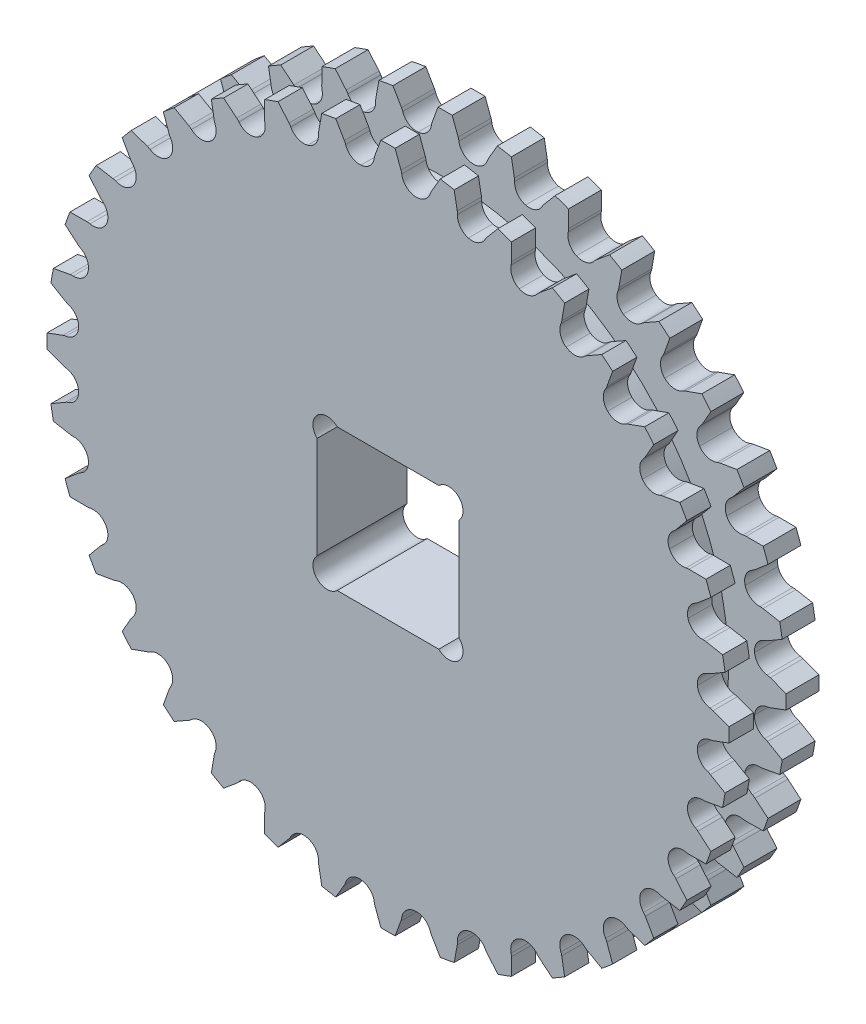
from build123d import *

# Parameters (mm, degrees)
BOSS_EXTRUDE1_DEPTH = 2.7178
SKETCH3_R           = 31.75
BOSS_EXTRUDE2_DEPTH = 3.683
BOSS_EXTRUDE3_START = -7.366
BOSS_EXTRUDE3_DEPTH = 3.683
CUT_EXTRUDE1_DEPTH  = 55.958234211


with BuildPart() as part:
    # Sketch1 → Boss-Extrude1 (new body)
    with BuildSketch(Plane.XY):
        with BuildLine():
            Line((-0.79375, 38.193352871), (-1.455433385, 36.407220044))
            ThreePointArc((-1.455433385, 36.407220044), (-1.506568103, 36.242096667), (-1.539446388, 36.072392492))
            ThreePointArc((-1.539446388, 36.072392492), (-2.036903793, 35.101653222), (-3.031134542, 34.65298428))
            ThreePointArc((-3.031134542, 34.65298428), (-4.088628405, 34.922119937), (-4.747846482, 35.791693855))
            ThreePointArc((-4.747846482, 35.791693855), (-4.809694093, 35.953110589), (-4.888725333, 36.10684592))
            Line((-4.888725333, 36.10684592), (-5.850514971, 37.750943262))
            ThreePointArc((-5.850514971, 37.750943262), (-6.633638224, 37.621231857), (-7.413897279, 37.475276779))
            Line((-7.413897279, 37.475276779), (-7.755369496, 35.60137921))
            ThreePointArc((-7.755369496, 35.60137921), (-7.777053989, 35.429884978), (-7.779963958, 35.257049736))
            ThreePointArc((-7.779963958, 35.257049736), (-8.101296763, 34.214675605), (-9.002512368, 33.600176594))
            ThreePointArc((-9.002512368, 33.600176594), (-10.090853136, 33.681184022), (-10.890878439, 34.423482713))
            ThreePointArc((-10.890878439, 34.423482713), (-10.979816168, 34.571707439), (-11.084342606, 34.709383554))
            Line((-11.084342606, 34.709383554), (-12.317015005, 36.161490344))
            ThreePointArc((-12.317015005, 36.161490344), (-13.065716707, 35.897761622), (-13.808777041, 35.618533367))
            Line((-13.808777041, 35.618533367), (-13.81966263, 33.713808484))
            ThreePointArc((-13.81966263, 33.713808484), (-13.811238025, 33.541154162), (-13.784091261, 33.370439364))
            ThreePointArc((-13.784091261, 33.370439364), (-13.91953593, 32.288102383), (-14.700353411, 31.526444545))
            ThreePointArc((-14.700353411, 31.526444545), (-15.78622663, 31.417232897), (-16.702996566, 32.009331467))
            ThreePointArc((-16.702996566, 32.009331467), (-16.816322084, 32.139860452), (-16.943167737, 32.257294132))
            Line((-16.943167737, 32.257294132), (-18.409268771, 33.473288842))
            ThreePointArc((-18.409268771, 33.473288842), (-19.1008, 33.083556065), (-19.7840841, 32.679538842))
            Line((-19.7840841, 32.679538842), (-19.464052307, 30.801860747))
            ThreePointArc((-19.464052307, 30.801860747), (-19.425774583, 30.633292349), (-19.369395925, 30.469885079))
            ThreePointArc((-19.369395925, 30.469885079), (-19.314837041, 29.380471508), (-19.951531655, 28.494797432))
            ThreePointArc((-19.951531655, 28.494797432), (-21.001943616, 28.198685049), (-22.007602595, 28.622592882))
            ThreePointArc((-22.007602595, 28.622592882), (-22.141872564, 28.731460069), (-22.287183291, 28.825083151))
            Line((-22.287183291, 28.825083151), (-23.942166221, 29.768018396))
            ThreePointArc((-23.942166221, 29.768018396), (-24.55551515, 29.264123398), (-25.158261774, 28.747593065))
            Line((-25.158261774, 28.747593065), (-24.517036604, 26.954014058))
            ThreePointArc((-24.517036604, 26.954014058), (-24.45006881, 26.79465345), (-24.366171296, 26.643518754))
            ThreePointArc((-24.366171296, 26.643518754), (-24.123266603, 25.580129874), (-24.596492706, 24.597350318))
            ThreePointArc((-24.596492706, 24.597350318), (-25.579527173, 24.123334424), (-26.643518754, 24.366171296))
            ThreePointArc((-26.643518754, 24.366171296), (-26.79465345, 24.45006881), (-26.954014058, 24.517036604))
            Line((-26.954014058, 24.517036604), (-28.747593065, 25.158261774))
            ThreePointArc((-28.747593065, 25.158261774), (-29.264123398, 24.55551515), (-29.768018396, 23.942166221))
            Line((-29.768018396, 23.942166221), (-28.825083151, 22.287183291))
            ThreePointArc((-28.825083151, 22.287183291), (-28.731460069, 22.141872564), (-28.622592882, 22.007602595))
            ThreePointArc((-28.622592882, 22.007602595), (-28.198722915, 21.002548938), (-28.494101772, 19.952525162))
            ThreePointArc((-28.494101772, 19.952525162), (-29.37988974, 19.315008491), (-30.469885079, 19.369395925))
            ThreePointArc((-30.469885079, 19.369395925), (-30.633292349, 19.425774583), (-30.801860747, 19.464052307))
            Line((-30.801860747, 19.464052307), (-32.679538842, 19.7840841))
            ThreePointArc((-32.679538842, 19.7840841), (-33.083556065, 19.1008), (-33.473288842, 18.409268771))
            Line((-33.473288842, 18.409268771), (-32.257294132, 16.943167737))
            ThreePointArc((-32.257294132, 16.943167737), (-32.139860452, 16.816322084), (-32.009331467, 16.702996566))
            ThreePointArc((-32.009331467, 16.702996566), (-31.417375302, 15.786816181), (-31.525931974, 14.701452624))
            ThreePointArc((-31.525931974, 14.701452624), (-32.287559225, 13.919805797), (-33.370439364, 13.784091261))
            ThreePointArc((-33.370439364, 13.784091261), (-33.541154162, 13.811238025), (-33.713808484, 13.81966263))
            Line((-33.713808484, 13.81966263), (-35.618533367, 13.808777041))
            ThreePointArc((-35.618533367, 13.808777041), (-35.897761622, 13.065716707), (-36.161490344, 12.317015005))
            Line((-36.161490344, 12.317015005), (-34.709383554, 11.084342606))
            ThreePointArc((-34.709383554, 11.084342606), (-34.571707439, 10.979816168), (-34.423482713, 10.890878439))
            ThreePointArc((-34.423482713, 10.890878439), (-33.681426637, 10.091409002), (-33.599862686, 9.003683889))
            ThreePointArc((-33.599862686, 9.003683889), (-34.21445168, 8.102014525), (-35.257049736, 7.779963958))
            ThreePointArc((-35.257049736, 7.779963958), (-35.429884978, 7.777053989), (-35.60137921, 7.755369496))
            Line((-35.60137921, 7.755369496), (-37.475276779, 7.413897279))
            ThreePointArc((-37.475276779, 7.413897279), (-37.621231857, 6.633638224), (-37.750943262, 5.850514971))
            Line((-37.750943262, 5.850514971), (-36.10684592, 4.888725333))
            ThreePointArc((-36.10684592, 4.888725333), (-35.953110589, 4.809694093), (-35.791693855, 4.747846482))
            ThreePointArc((-35.791693855, 4.747846482), (-34.922084868, 4.089379467), (-34.652878573, 3.032342774))
            ThreePointArc((-34.652878573, 3.032342774), (-35.101557337, 2.037649535), (-36.072392492, 1.539446388))
            ThreePointArc((-36.072392492, 1.539446388), (-36.242096667, 1.506568103), (-36.407220044, 1.455433385))
            Line((-36.407220044, 1.455433385), (-38.193352871, 0.79375))
            ThreePointArc((-38.193352871, 0.79375), (-38.2016, 0), (-38.193352871, -0.79375))
            Line((-38.193352871, -0.79375), (-36.407220044, -1.455433385))
            ThreePointArc((-36.407220044, -1.455433385), (-36.242096667, -1.506568103), (-36.072392492, -1.539446388))
            ThreePointArc((-36.072392492, -1.539446388), (-35.101653222, -2.036903793), (-34.65298428, -3.031134542))
            ThreePointArc((-34.65298428, -3.031134542), (-34.922119937, -4.088628405), (-35.791693855, -4.747846482))
            ThreePointArc((-35.791693855, -4.747846482), (-35.953110589, -4.809694093), (-36.10684592, -4.888725333))
            Line((-36.10684592, -4.888725333), (-37.750943262, -5.850514971))
            ThreePointArc((-37.750943262, -5.850514971), (-37.621231857, -6.633638224), (-37.475276779, -7.413897279))
            Line((-37.475276779, -7.413897279), (-35.60137921, -7.755369496))
            ThreePointArc((-35.60137921, -7.755369496), (-35.429884978, -7.777053989), (-35.257049736, -7.779963958))
            ThreePointArc((-35.257049736, -7.779963958), (-34.214675605, -8.101296763), (-33.600176594, -9.002512368))
            ThreePointArc((-33.600176594, -9.002512368), (-33.681591594, -10.09067544), (-34.423482713, -10.890878439))
            ThreePointArc((-34.423482713, -10.890878439), (-34.571707439, -10.979816168), (-34.709383554, -11.084342606))
            Line((-34.709383554, -11.084342606), (-36.161490344, -12.317015005))
            ThreePointArc((-36.161490344, -12.317015005), (-35.897761622, -13.065716707), (-35.618533367, -13.808777041))
            Line((-35.618533367, -13.808777041), (-33.713808484, -13.81966263))
            ThreePointArc((-33.713808484, -13.81966263), (-33.541154162, -13.811238025), (-33.370439364, -13.784091261))
            ThreePointArc((-33.370439364, -13.784091261), (-32.288102383, -13.91953593), (-31.526444545, -14.700353411))
            ThreePointArc((-31.526444545, -14.700353411), (-31.417665134, -15.786122407), (-32.009331467, -16.702996566))
            ThreePointArc((-32.009331467, -16.702996566), (-32.139860452, -16.816322084), (-32.257294132, -16.943167737))
            Line((-32.257294132, -16.943167737), (-33.473288842, -18.409268771))
            ThreePointArc((-33.473288842, -18.409268771), (-33.083556065, -19.1008), (-32.679538842, -19.7840841))
            Line((-32.679538842, -19.7840841), (-30.801860747, -19.464052307))
            ThreePointArc((-30.801860747, -19.464052307), (-30.633292349, -19.425774583), (-30.469885079, -19.369395925))
            ThreePointArc((-30.469885079, -19.369395925), (-29.380471508, -19.314837041), (-28.494797432, -19.951531655))
            ThreePointArc((-28.494797432, -19.951531655), (-28.198685049, -21.001943616), (-28.622592882, -22.007602595))
            ThreePointArc((-28.622592882, -22.007602595), (-28.731460069, -22.141872564), (-28.825083151, -22.287183291))
            Line((-28.825083151, -22.287183291), (-29.768018396, -23.942166221))
            ThreePointArc((-29.768018396, -23.942166221), (-29.264123398, -24.55551515), (-28.747593065, -25.158261774))
            Line((-28.747593065, -25.158261774), (-26.954014058, -24.517036604))
            ThreePointArc((-26.954014058, -24.517036604), (-26.79465345, -24.45006881), (-26.643518754, -24.366171296))
            ThreePointArc((-26.643518754, -24.366171296), (-25.580129874, -24.123266603), (-24.597350318, -24.596492706))
            ThreePointArc((-24.597350318, -24.596492706), (-24.12377624, -25.579577069), (-24.366171296, -26.643518754))
            ThreePointArc((-24.366171296, -26.643518754), (-24.45006881, -26.79465345), (-24.517036604, -26.954014058))
            Line((-24.517036604, -26.954014058), (-25.158261774, -28.747593065))
            ThreePointArc((-25.158261774, -28.747593065), (-24.55551515, -29.264123398), (-23.942166221, -29.768018396))
            Line((-23.942166221, -29.768018396), (-22.287183291, -28.825083151))
            ThreePointArc((-22.287183291, -28.825083151), (-22.141872564, -28.731460069), (-22.007602595, -28.622592882))
            ThreePointArc((-22.007602595, -28.622592882), (-21.002548938, -28.198722915), (-19.952525162, -28.494101772))
            ThreePointArc((-19.952525162, -28.494101772), (-19.31543493, -29.380015599), (-19.369395925, -30.469885079))
            ThreePointArc((-19.369395925, -30.469885079), (-19.425774583, -30.633292349), (-19.464052307, -30.801860747))
            Line((-19.464052307, -30.801860747), (-19.7840841, -32.679538842))
            ThreePointArc((-19.7840841, -32.679538842), (-19.1008, -33.083556065), (-18.409268771, -33.473288842))
            Line((-18.409268771, -33.473288842), (-16.943167737, -32.257294132))
            ThreePointArc((-16.943167737, -32.257294132), (-16.816322084, -32.139860452), (-16.702996566, -32.009331467))
            ThreePointArc((-16.702996566, -32.009331467), (-15.786816181, -31.417375302), (-14.701452624, -31.525931974))
            ThreePointArc((-14.701452624, -31.525931974), (-13.920203903, -32.287757222), (-13.784091261, -33.370439364))
            ThreePointArc((-13.784091261, -33.370439364), (-13.811238025, -33.541154162), (-13.81966263, -33.713808484))
            Line((-13.81966263, -33.713808484), (-13.808777041, -35.618533367))
            ThreePointArc((-13.808777041, -35.618533367), (-13.065716707, -35.897761622), (-12.317015005, -36.161490344))
            Line((-12.317015005, -36.161490344), (-11.084342606, -34.709383554))
            ThreePointArc((-11.084342606, -34.709383554), (-10.979816168, -34.571707439), (-10.890878439, -34.423482713))
            ThreePointArc((-10.890878439, -34.423482713), (-10.091409002, -33.681426637), (-9.003683889, -33.599862686))
            ThreePointArc((-9.003683889, -33.599862686), (-8.102014525, -34.21445168), (-7.779963958, -35.257049736))
            ThreePointArc((-7.779963958, -35.257049736), (-7.777053989, -35.429884978), (-7.755369496, -35.60137921))
            Line((-7.755369496, -35.60137921), (-7.413897279, -37.475276779))
            ThreePointArc((-7.413897279, -37.475276779), (-6.633638224, -37.621231857), (-5.850514971, -37.750943262))
            Line((-5.850514971, -37.750943262), (-4.888725333, -36.10684592))
            ThreePointArc((-4.888725333, -36.10684592), (-4.809694093, -35.953110589), (-4.747846482, -35.791693855))
            ThreePointArc((-4.747846482, -35.791693855), (-4.089379467, -34.922084868), (-3.032342774, -34.652878573))
            ThreePointArc((-3.032342774, -34.652878573), (-2.037649535, -35.101557337), (-1.539446388, -36.072392492))
            ThreePointArc((-1.539446388, -36.072392492), (-1.506568103, -36.242096667), (-1.455433385, -36.407220044))
            Line((-1.455433385, -36.407220044), (-0.79375, -38.193352871))
            ThreePointArc((-0.79375, -38.193352871), (0, -38.2016), (0.79375, -38.193352871))
            Line((0.79375, -38.193352871), (1.455433385, -36.407220044))
            ThreePointArc((1.455433385, -36.407220044), (1.506568103, -36.242096667), (1.539446388, -36.072392492))
            ThreePointArc((1.539446388, -36.072392492), (2.036903793, -35.101653222), (3.031134542, -34.65298428))
            ThreePointArc((3.031134542, -34.65298428), (4.088628405, -34.922119937), (4.747846482, -35.791693855))
            ThreePointArc((4.747846482, -35.791693855), (4.809694093, -35.953110589), (4.888725333, -36.10684592))
            Line((4.888725333, -36.10684592), (5.850514971, -37.750943262))
            ThreePointArc((5.850514971, -37.750943262), (6.633638224, -37.621231857), (7.413897279, -37.475276779))
            Line((7.413897279, -37.475276779), (7.755369496, -35.60137921))
            ThreePointArc((7.755369496, -35.60137921), (7.777053989, -35.429884978), (7.779963958, -35.257049736))
            ThreePointArc((7.779963958, -35.257049736), (8.101296763, -34.214675605), (9.002512368, -33.600176594))
            ThreePointArc((9.002512368, -33.600176594), (10.09067544, -33.681591594), (10.890878439, -34.423482713))
            ThreePointArc((10.890878439, -34.423482713), (10.979816168, -34.571707439), (11.084342606, -34.709383554))
            Line((11.084342606, -34.709383554), (12.317015005, -36.161490344))
            ThreePointArc((12.317015005, -36.161490344), (13.065716707, -35.897761622), (13.808777041, -35.618533367))
            Line((13.808777041, -35.618533367), (13.81966263, -33.713808484))
            ThreePointArc((13.81966263, -33.713808484), (13.811238025, -33.541154162), (13.784091261, -33.370439364))
            ThreePointArc((13.784091261, -33.370439364), (13.91953593, -32.288102383), (14.700353411, -31.526444545))
            ThreePointArc((14.700353411, -31.526444545), (15.78622663, -31.417232897), (16.702996566, -32.009331467))
            ThreePointArc((16.702996566, -32.009331467), (16.816322084, -32.139860452), (16.943167737, -32.257294132))
            Line((16.943167737, -32.257294132), (18.409268771, -33.473288842))
            ThreePointArc((18.409268771, -33.473288842), (19.1008, -33.083556065), (19.7840841, -32.679538842))
            Line((19.7840841, -32.679538842), (19.464052307, -30.801860747))
            ThreePointArc((19.464052307, -30.801860747), (19.425774583, -30.633292349), (19.369395925, -30.469885079))
            ThreePointArc((19.369395925, -30.469885079), (19.314837041, -29.380471508), (19.951531655, -28.494797432))
            ThreePointArc((19.951531655, -28.494797432), (21.001916034, -28.199128817), (22.007602595, -28.622592882))
            ThreePointArc((22.007602595, -28.622592882), (22.141872564, -28.731460069), (22.287183291, -28.825083151))
            Line((22.287183291, -28.825083151), (23.942166221, -29.768018396))
            ThreePointArc((23.942166221, -29.768018396), (24.55551515, -29.264123398), (25.158261774, -28.747593065))
            Line((25.158261774, -28.747593065), (24.517036604, -26.954014058))
            ThreePointArc((24.517036604, -26.954014058), (24.45006881, -26.79465345), (24.366171296, -26.643518754))
            ThreePointArc((24.366171296, -26.643518754), (24.123266603, -25.580129874), (24.596492706, -24.597350318))
            ThreePointArc((24.596492706, -24.597350318), (25.579527173, -24.123334424), (26.643518754, -24.366171296))
            ThreePointArc((26.643518754, -24.366171296), (26.79465345, -24.45006881), (26.954014058, -24.517036604))
            Line((26.954014058, -24.517036604), (28.747593065, -25.158261774))
            ThreePointArc((28.747593065, -25.158261774), (29.264123398, -24.55551515), (29.768018396, -23.942166221))
            Line((29.768018396, -23.942166221), (28.825083151, -22.287183291))
            ThreePointArc((28.825083151, -22.287183291), (28.731460069, -22.141872564), (28.622592882, -22.007602595))
            ThreePointArc((28.622592882, -22.007602595), (28.198722915, -21.002548938), (28.494101772, -19.952525162))
            ThreePointArc((28.494101772, -19.952525162), (29.37988974, -19.315008491), (30.469885079, -19.369395925))
            ThreePointArc((30.469885079, -19.369395925), (30.633292349, -19.425774583), (30.801860747, -19.464052307))
            Line((30.801860747, -19.464052307), (32.679538842, -19.7840841))
            ThreePointArc((32.679538842, -19.7840841), (33.083556065, -19.1008), (33.473288842, -18.409268771))
            Line((33.473288842, -18.409268771), (32.257294132, -16.943167737))
            ThreePointArc((32.257294132, -16.943167737), (32.139860452, -16.816322084), (32.009331467, -16.702996566))
            ThreePointArc((32.009331467, -16.702996566), (31.417375302, -15.786816181), (31.525931974, -14.701452624))
            ThreePointArc((31.525931974, -14.701452624), (32.287559225, -13.919805797), (33.370439364, -13.784091261))
            ThreePointArc((33.370439364, -13.784091261), (33.541154162, -13.811238025), (33.713808484, -13.81966263))
            Line((33.713808484, -13.81966263), (35.618533367, -13.808777041))
            ThreePointArc((35.618533367, -13.808777041), (35.897761622, -13.065716707), (36.161490344, -12.317015005))
            Line((36.161490344, -12.317015005), (34.709383554, -11.084342606))
            ThreePointArc((34.709383554, -11.084342606), (34.571707439, -10.979816168), (34.423482713, -10.890878439))
            ThreePointArc((34.423482713, -10.890878439), (33.681426637, -10.091409002), (33.599862686, -9.003683889))
            ThreePointArc((33.599862686, -9.003683889), (34.214187561, -8.101656849), (35.257049736, -7.779963958))
            ThreePointArc((35.257049736, -7.779963958), (35.429884978, -7.777053989), (35.60137921, -7.755369496))
            Line((35.60137921, -7.755369496), (37.475276779, -7.413897279))
            ThreePointArc((37.475276779, -7.413897279), (37.621231857, -6.633638224), (37.750943262, -5.850514971))
            Line((37.750943262, -5.850514971), (36.10684592, -4.888725333))
            ThreePointArc((36.10684592, -4.888725333), (35.953110589, -4.809694093), (35.791693855, -4.747846482))
            ThreePointArc((35.791693855, -4.747846482), (34.922084868, -4.089379467), (34.652878573, -3.032342774))
            ThreePointArc((34.652878573, -3.032342774), (35.101235121, -2.037343157), (36.072392492, -1.539446388))
            ThreePointArc((36.072392492, -1.539446388), (36.242096667, -1.506568103), (36.407220044, -1.455433385))
            Line((36.407220044, -1.455433385), (38.193352871, -0.79375))
            ThreePointArc((38.193352871, -0.79375), (38.2016, 0), (38.193352871, 0.79375))
            Line((38.193352871, 0.79375), (36.407220044, 1.455433385))
            ThreePointArc((36.407220044, 1.455433385), (36.242096667, 1.506568103), (36.072392492, 1.539446388))
            ThreePointArc((36.072392492, 1.539446388), (35.101653222, 2.036903793), (34.65298428, 3.031134542))
            ThreePointArc((34.65298428, 3.031134542), (34.921749414, 4.088874176), (35.791693855, 4.747846482))
            ThreePointArc((35.791693855, 4.747846482), (35.953110589, 4.809694093), (36.10684592, 4.888725333))
            Line((36.10684592, 4.888725333), (37.750943262, 5.850514971))
            ThreePointArc((37.750943262, 5.850514971), (37.621231857, 6.633638224), (37.475276779, 7.413897279))
            Line((37.475276779, 7.413897279), (35.60137921, 7.755369496))
            ThreePointArc((35.60137921, 7.755369496), (35.429884978, 7.777053989), (35.257049736, 7.779963958))
            ThreePointArc((35.257049736, 7.779963958), (34.214675605, 8.101296763), (33.600176594, 9.002512368))
            ThreePointArc((33.600176594, 9.002512368), (33.681184022, 10.090853136), (34.423482713, 10.890878439))
            ThreePointArc((34.423482713, 10.890878439), (34.571707439, 10.979816168), (34.709383554, 11.084342606))
            Line((34.709383554, 11.084342606), (36.161490344, 12.317015005))
            ThreePointArc((36.161490344, 12.317015005), (35.897761622, 13.065716707), (35.618533367, 13.808777041))
            Line((35.618533367, 13.808777041), (33.713808484, 13.81966263))
            ThreePointArc((33.713808484, 13.81966263), (33.541154162, 13.811238025), (33.370439364, 13.784091261))
            ThreePointArc((33.370439364, 13.784091261), (32.288102383, 13.91953593), (31.526444545, 14.700353411))
            ThreePointArc((31.526444545, 14.700353411), (31.417232897, 15.78622663), (32.009331467, 16.702996566))
            ThreePointArc((32.009331467, 16.702996566), (32.139860452, 16.816322084), (32.257294132, 16.943167737))
            Line((32.257294132, 16.943167737), (33.473288842, 18.409268771))
            ThreePointArc((33.473288842, 18.409268771), (33.083556065, 19.1008), (32.679538842, 19.7840841))
            Line((32.679538842, 19.7840841), (30.801860747, 19.464052307))
            ThreePointArc((30.801860747, 19.464052307), (30.633292349, 19.425774583), (30.469885079, 19.369395925))
            ThreePointArc((30.469885079, 19.369395925), (29.380471508, 19.314837041), (28.494797432, 19.951531655))
            ThreePointArc((28.494797432, 19.951531655), (28.198685049, 21.001943616), (28.622592882, 22.007602595))
            ThreePointArc((28.622592882, 22.007602595), (28.731460069, 22.141872564), (28.825083151, 22.287183291))
            Line((28.825083151, 22.287183291), (29.768018396, 23.942166221))
            ThreePointArc((29.768018396, 23.942166221), (29.264123398, 24.55551515), (28.747593065, 25.158261774))
            Line((28.747593065, 25.158261774), (26.954014058, 24.517036604))
            ThreePointArc((26.954014058, 24.517036604), (26.79465345, 24.45006881), (26.643518754, 24.366171296))
            ThreePointArc((26.643518754, 24.366171296), (25.580129874, 24.123266603), (24.597350318, 24.596492706))
            ThreePointArc((24.597350318, 24.596492706), (24.12377624, 25.579577069), (24.366171296, 26.643518754))
            ThreePointArc((24.366171296, 26.643518754), (24.45006881, 26.79465345), (24.517036604, 26.954014058))
            Line((24.517036604, 26.954014058), (25.158261774, 28.747593065))
            ThreePointArc((25.158261774, 28.747593065), (24.55551515, 29.264123398), (23.942166221, 29.768018396))
            Line((23.942166221, 29.768018396), (22.287183291, 28.825083151))
            ThreePointArc((22.287183291, 28.825083151), (22.141872564, 28.731460069), (22.007602595, 28.622592882))
            ThreePointArc((22.007602595, 28.622592882), (21.002548938, 28.198722915), (19.952525162, 28.494101772))
            ThreePointArc((19.952525162, 28.494101772), (19.315008491, 29.37988974), (19.369395925, 30.469885079))
            ThreePointArc((19.369395925, 30.469885079), (19.425774583, 30.633292349), (19.464052307, 30.801860747))
            Line((19.464052307, 30.801860747), (19.7840841, 32.679538842))
            ThreePointArc((19.7840841, 32.679538842), (19.1008, 33.083556065), (18.409268771, 33.473288842))
            Line((18.409268771, 33.473288842), (16.943167737, 32.257294132))
            ThreePointArc((16.943167737, 32.257294132), (16.816322084, 32.139860452), (16.702996566, 32.009331467))
            ThreePointArc((16.702996566, 32.009331467), (15.786816181, 31.417375302), (14.701452624, 31.525931974))
            ThreePointArc((14.701452624, 31.525931974), (13.919805797, 32.287559225), (13.784091261, 33.370439364))
            ThreePointArc((13.784091261, 33.370439364), (13.811238025, 33.541154162), (13.81966263, 33.713808484))
            Line((13.81966263, 33.713808484), (13.808777041, 35.618533367))
            ThreePointArc((13.808777041, 35.618533367), (13.065716707, 35.897761622), (12.317015005, 36.161490344))
            Line((12.317015005, 36.161490344), (11.084342606, 34.709383554))
            ThreePointArc((11.084342606, 34.709383554), (10.979816168, 34.571707439), (10.890878439, 34.423482713))
            ThreePointArc((10.890878439, 34.423482713), (10.091409002, 33.681426637), (9.003683889, 33.599862686))
            ThreePointArc((9.003683889, 33.599862686), (8.102014525, 34.21445168), (7.779963958, 35.257049736))
            ThreePointArc((7.779963958, 35.257049736), (7.777053989, 35.429884978), (7.755369496, 35.60137921))
            Line((7.755369496, 35.60137921), (7.413897279, 37.475276779))
            ThreePointArc((7.413897279, 37.475276779), (6.633638224, 37.621231857), (5.850514971, 37.750943262))
            Line((5.850514971, 37.750943262), (4.888725333, 36.10684592))
            ThreePointArc((4.888725333, 36.10684592), (4.809694093, 35.953110589), (4.747846482, 35.791693855))
            ThreePointArc((4.747846482, 35.791693855), (3.031694497, 34.652426671), (1.539446388, 36.072392492))
            ThreePointArc((1.539446388, 36.072392492), (1.506568103, 36.242096667), (1.455433385, 36.407220044))
            Line((1.455433385, 36.407220044), (0.79375, 38.193352871))
            ThreePointArc((0.79375, 38.193352871), (0, 38.2016), (-0.79375, 38.193352871))
        make_face()
    extrude(amount=BOSS_EXTRUDE1_DEPTH)

    # Sketch3 → Boss-Extrude2 (add)
    with BuildSketch(Plane(origin=(0, 0, 0), x_dir=(-1, 0, 0), z_dir=(0, 0, -1))):
        with Locations(Location((0, 0, 0), (0, 0, 180))):
            Circle(SKETCH3_R)
    extrude(amount=BOSS_EXTRUDE2_DEPTH)

    # Sketch1<2> → Boss-Extrude3 (add)
    with BuildSketch(Plane.XY.offset(BOSS_EXTRUDE3_START)):
        with BuildLine():
            Line((-0.79375, 38.193352871), (-1.455433385, 36.407220044))
            ThreePointArc((-1.455433385, 36.407220044), (-1.506568103, 36.242096667), (-1.539446388, 36.072392492))
            ThreePointArc((-1.539446388, 36.072392492), (-2.036903793, 35.101653222), (-3.031134542, 34.65298428))
            ThreePointArc((-3.031134542, 34.65298428), (-4.088628405, 34.922119937), (-4.747846482, 35.791693855))
            ThreePointArc((-4.747846482, 35.791693855), (-4.809694093, 35.953110589), (-4.888725333, 36.10684592))
            Line((-4.888725333, 36.10684592), (-5.850514971, 37.750943262))
            ThreePointArc((-5.850514971, 37.750943262), (-6.633638224, 37.621231857), (-7.413897279, 37.475276779))
            Line((-7.413897279, 37.475276779), (-7.755369496, 35.60137921))
            ThreePointArc((-7.755369496, 35.60137921), (-7.777053989, 35.429884978), (-7.779963958, 35.257049736))
            ThreePointArc((-7.779963958, 35.257049736), (-8.101296763, 34.214675605), (-9.002512368, 33.600176594))
            ThreePointArc((-9.002512368, 33.600176594), (-10.090853136, 33.681184022), (-10.890878439, 34.423482713))
            ThreePointArc((-10.890878439, 34.423482713), (-10.979816168, 34.571707439), (-11.084342606, 34.709383554))
            Line((-11.084342606, 34.709383554), (-12.317015005, 36.161490344))
            ThreePointArc((-12.317015005, 36.161490344), (-13.065716707, 35.897761622), (-13.808777041, 35.618533367))
            Line((-13.808777041, 35.618533367), (-13.81966263, 33.713808484))
            ThreePointArc((-13.81966263, 33.713808484), (-13.811238025, 33.541154162), (-13.784091261, 33.370439364))
            ThreePointArc((-13.784091261, 33.370439364), (-13.91953593, 32.288102383), (-14.700353411, 31.526444545))
            ThreePointArc((-14.700353411, 31.526444545), (-15.78622663, 31.417232897), (-16.702996566, 32.009331467))
            ThreePointArc((-16.702996566, 32.009331467), (-16.816322084, 32.139860452), (-16.943167737, 32.257294132))
            Line((-16.943167737, 32.257294132), (-18.409268771, 33.473288842))
            ThreePointArc((-18.409268771, 33.473288842), (-19.1008, 33.083556065), (-19.7840841, 32.679538842))
            Line((-19.7840841, 32.679538842), (-19.464052307, 30.801860747))
            ThreePointArc((-19.464052307, 30.801860747), (-19.425774583, 30.633292349), (-19.369395925, 30.469885079))
            ThreePointArc((-19.369395925, 30.469885079), (-19.314837041, 29.380471508), (-19.951531655, 28.494797432))
            ThreePointArc((-19.951531655, 28.494797432), (-21.001943616, 28.198685049), (-22.007602595, 28.622592882))
            ThreePointArc((-22.007602595, 28.622592882), (-22.141872564, 28.731460069), (-22.287183291, 28.825083151))
            Line((-22.287183291, 28.825083151), (-23.942166221, 29.768018396))
            ThreePointArc((-23.942166221, 29.768018396), (-24.55551515, 29.264123398), (-25.158261774, 28.747593065))
            Line((-25.158261774, 28.747593065), (-24.517036604, 26.954014058))
            ThreePointArc((-24.517036604, 26.954014058), (-24.45006881, 26.79465345), (-24.366171296, 26.643518754))
            ThreePointArc((-24.366171296, 26.643518754), (-24.123266603, 25.580129874), (-24.596492706, 24.597350318))
            ThreePointArc((-24.596492706, 24.597350318), (-25.579527173, 24.123334424), (-26.643518754, 24.366171296))
            ThreePointArc((-26.643518754, 24.366171296), (-26.79465345, 24.45006881), (-26.954014058, 24.517036604))
            Line((-26.954014058, 24.517036604), (-28.747593065, 25.158261774))
            ThreePointArc((-28.747593065, 25.158261774), (-29.264123398, 24.55551515), (-29.768018396, 23.942166221))
            Line((-29.768018396, 23.942166221), (-28.825083151, 22.287183291))
            ThreePointArc((-28.825083151, 22.287183291), (-28.731460069, 22.141872564), (-28.622592882, 22.007602595))
            ThreePointArc((-28.622592882, 22.007602595), (-28.198722915, 21.002548938), (-28.494101772, 19.952525162))
            ThreePointArc((-28.494101772, 19.952525162), (-29.37988974, 19.315008491), (-30.469885079, 19.369395925))
            ThreePointArc((-30.469885079, 19.369395925), (-30.633292349, 19.425774583), (-30.801860747, 19.464052307))
            Line((-30.801860747, 19.464052307), (-32.679538842, 19.7840841))
            ThreePointArc((-32.679538842, 19.7840841), (-33.083556065, 19.1008), (-33.473288842, 18.409268771))
            Line((-33.473288842, 18.409268771), (-32.257294132, 16.943167737))
            ThreePointArc((-32.257294132, 16.943167737), (-32.139860452, 16.816322084), (-32.009331467, 16.702996566))
            ThreePointArc((-32.009331467, 16.702996566), (-31.417375302, 15.786816181), (-31.525931974, 14.701452624))
            ThreePointArc((-31.525931974, 14.701452624), (-32.287559225, 13.919805797), (-33.370439364, 13.784091261))
            ThreePointArc((-33.370439364, 13.784091261), (-33.541154162, 13.811238025), (-33.713808484, 13.81966263))
            Line((-33.713808484, 13.81966263), (-35.618533367, 13.808777041))
            ThreePointArc((-35.618533367, 13.808777041), (-35.897761622, 13.065716707), (-36.161490344, 12.317015005))
            Line((-36.161490344, 12.317015005), (-34.709383554, 11.084342606))
            ThreePointArc((-34.709383554, 11.084342606), (-34.571707439, 10.979816168), (-34.423482713, 10.890878439))
            ThreePointArc((-34.423482713, 10.890878439), (-33.681426637, 10.091409002), (-33.599862686, 9.003683889))
            ThreePointArc((-33.599862686, 9.003683889), (-34.21445168, 8.102014525), (-35.257049736, 7.779963958))
            ThreePointArc((-35.257049736, 7.779963958), (-35.429884978, 7.777053989), (-35.60137921, 7.755369496))
            Line((-35.60137921, 7.755369496), (-37.475276779, 7.413897279))
            ThreePointArc((-37.475276779, 7.413897279), (-37.621231857, 6.633638224), (-37.750943262, 5.850514971))
            Line((-37.750943262, 5.850514971), (-36.10684592, 4.888725333))
            ThreePointArc((-36.10684592, 4.888725333), (-35.953110589, 4.809694093), (-35.791693855, 4.747846482))
            ThreePointArc((-35.791693855, 4.747846482), (-34.922084868, 4.089379467), (-34.652878573, 3.032342774))
            ThreePointArc((-34.652878573, 3.032342774), (-35.101557337, 2.037649535), (-36.072392492, 1.539446388))
            ThreePointArc((-36.072392492, 1.539446388), (-36.242096667, 1.506568103), (-36.407220044, 1.455433385))
            Line((-36.407220044, 1.455433385), (-38.193352871, 0.79375))
            ThreePointArc((-38.193352871, 0.79375), (-38.2016, 0), (-38.193352871, -0.79375))
            Line((-38.193352871, -0.79375), (-36.407220044, -1.455433385))
            ThreePointArc((-36.407220044, -1.455433385), (-36.242096667, -1.506568103), (-36.072392492, -1.539446388))
            ThreePointArc((-36.072392492, -1.539446388), (-35.101653222, -2.036903793), (-34.65298428, -3.031134542))
            ThreePointArc((-34.65298428, -3.031134542), (-34.922119937, -4.088628405), (-35.791693855, -4.747846482))
            ThreePointArc((-35.791693855, -4.747846482), (-35.953110589, -4.809694093), (-36.10684592, -4.888725333))
            Line((-36.10684592, -4.888725333), (-37.750943262, -5.850514971))
            ThreePointArc((-37.750943262, -5.850514971), (-37.621231857, -6.633638224), (-37.475276779, -7.413897279))
            Line((-37.475276779, -7.413897279), (-35.60137921, -7.755369496))
            ThreePointArc((-35.60137921, -7.755369496), (-35.429884978, -7.777053989), (-35.257049736, -7.779963958))
            ThreePointArc((-35.257049736, -7.779963958), (-34.214675605, -8.101296763), (-33.600176594, -9.002512368))
            ThreePointArc((-33.600176594, -9.002512368), (-33.681591594, -10.09067544), (-34.423482713, -10.890878439))
            ThreePointArc((-34.423482713, -10.890878439), (-34.571707439, -10.979816168), (-34.709383554, -11.084342606))
            Line((-34.709383554, -11.084342606), (-36.161490344, -12.317015005))
            ThreePointArc((-36.161490344, -12.317015005), (-35.897761622, -13.065716707), (-35.618533367, -13.808777041))
            Line((-35.618533367, -13.808777041), (-33.713808484, -13.81966263))
            ThreePointArc((-33.713808484, -13.81966263), (-33.541154162, -13.811238025), (-33.370439364, -13.784091261))
            ThreePointArc((-33.370439364, -13.784091261), (-32.288102383, -13.91953593), (-31.526444545, -14.700353411))
            ThreePointArc((-31.526444545, -14.700353411), (-31.417665134, -15.786122407), (-32.009331467, -16.702996566))
            ThreePointArc((-32.009331467, -16.702996566), (-32.139860452, -16.816322084), (-32.257294132, -16.943167737))
            Line((-32.257294132, -16.943167737), (-33.473288842, -18.409268771))
            ThreePointArc((-33.473288842, -18.409268771), (-33.083556065, -19.1008), (-32.679538842, -19.7840841))
            Line((-32.679538842, -19.7840841), (-30.801860747, -19.464052307))
            ThreePointArc((-30.801860747, -19.464052307), (-30.633292349, -19.425774583), (-30.469885079, -19.369395925))
            ThreePointArc((-30.469885079, -19.369395925), (-29.380471508, -19.314837041), (-28.494797432, -19.951531655))
            ThreePointArc((-28.494797432, -19.951531655), (-28.198685049, -21.001943616), (-28.622592882, -22.007602595))
            ThreePointArc((-28.622592882, -22.007602595), (-28.731460069, -22.141872564), (-28.825083151, -22.287183291))
            Line((-28.825083151, -22.287183291), (-29.768018396, -23.942166221))
            ThreePointArc((-29.768018396, -23.942166221), (-29.264123398, -24.55551515), (-28.747593065, -25.158261774))
            Line((-28.747593065, -25.158261774), (-26.954014058, -24.517036604))
            ThreePointArc((-26.954014058, -24.517036604), (-26.79465345, -24.45006881), (-26.643518754, -24.366171296))
            ThreePointArc((-26.643518754, -24.366171296), (-25.580129874, -24.123266603), (-24.597350318, -24.596492706))
            ThreePointArc((-24.597350318, -24.596492706), (-24.12377624, -25.579577069), (-24.366171296, -26.643518754))
            ThreePointArc((-24.366171296, -26.643518754), (-24.45006881, -26.79465345), (-24.517036604, -26.954014058))
            Line((-24.517036604, -26.954014058), (-25.158261774, -28.747593065))
            ThreePointArc((-25.158261774, -28.747593065), (-24.55551515, -29.264123398), (-23.942166221, -29.768018396))
            Line((-23.942166221, -29.768018396), (-22.287183291, -28.825083151))
            ThreePointArc((-22.287183291, -28.825083151), (-22.141872564, -28.731460069), (-22.007602595, -28.622592882))
            ThreePointArc((-22.007602595, -28.622592882), (-21.002548938, -28.198722915), (-19.952525162, -28.494101772))
            ThreePointArc((-19.952525162, -28.494101772), (-19.31543493, -29.380015599), (-19.369395925, -30.469885079))
            ThreePointArc((-19.369395925, -30.469885079), (-19.425774583, -30.633292349), (-19.464052307, -30.801860747))
            Line((-19.464052307, -30.801860747), (-19.7840841, -32.679538842))
            ThreePointArc((-19.7840841, -32.679538842), (-19.1008, -33.083556065), (-18.409268771, -33.473288842))
            Line((-18.409268771, -33.473288842), (-16.943167737, -32.257294132))
            ThreePointArc((-16.943167737, -32.257294132), (-16.816322084, -32.139860452), (-16.702996566, -32.009331467))
            ThreePointArc((-16.702996566, -32.009331467), (-15.786816181, -31.417375302), (-14.701452624, -31.525931974))
            ThreePointArc((-14.701452624, -31.525931974), (-13.920203903, -32.287757222), (-13.784091261, -33.370439364))
            ThreePointArc((-13.784091261, -33.370439364), (-13.811238025, -33.541154162), (-13.81966263, -33.713808484))
            Line((-13.81966263, -33.713808484), (-13.808777041, -35.618533367))
            ThreePointArc((-13.808777041, -35.618533367), (-13.065716707, -35.897761622), (-12.317015005, -36.161490344))
            Line((-12.317015005, -36.161490344), (-11.084342606, -34.709383554))
            ThreePointArc((-11.084342606, -34.709383554), (-10.979816168, -34.571707439), (-10.890878439, -34.423482713))
            ThreePointArc((-10.890878439, -34.423482713), (-10.091409002, -33.681426637), (-9.003683889, -33.599862686))
            ThreePointArc((-9.003683889, -33.599862686), (-8.102014525, -34.21445168), (-7.779963958, -35.257049736))
            ThreePointArc((-7.779963958, -35.257049736), (-7.777053989, -35.429884978), (-7.755369496, -35.60137921))
            Line((-7.755369496, -35.60137921), (-7.413897279, -37.475276779))
            ThreePointArc((-7.413897279, -37.475276779), (-6.633638224, -37.621231857), (-5.850514971, -37.750943262))
            Line((-5.850514971, -37.750943262), (-4.888725333, -36.10684592))
            ThreePointArc((-4.888725333, -36.10684592), (-4.809694093, -35.953110589), (-4.747846482, -35.791693855))
            ThreePointArc((-4.747846482, -35.791693855), (-4.089379467, -34.922084868), (-3.032342774, -34.652878573))
            ThreePointArc((-3.032342774, -34.652878573), (-2.037649535, -35.101557337), (-1.539446388, -36.072392492))
            ThreePointArc((-1.539446388, -36.072392492), (-1.506568103, -36.242096667), (-1.455433385, -36.407220044))
            Line((-1.455433385, -36.407220044), (-0.79375, -38.193352871))
            ThreePointArc((-0.79375, -38.193352871), (0, -38.2016), (0.79375, -38.193352871))
            Line((0.79375, -38.193352871), (1.455433385, -36.407220044))
            ThreePointArc((1.455433385, -36.407220044), (1.506568103, -36.242096667), (1.539446388, -36.072392492))
            ThreePointArc((1.539446388, -36.072392492), (2.036903793, -35.101653222), (3.031134542, -34.65298428))
            ThreePointArc((3.031134542, -34.65298428), (4.088628405, -34.922119937), (4.747846482, -35.791693855))
            ThreePointArc((4.747846482, -35.791693855), (4.809694093, -35.953110589), (4.888725333, -36.10684592))
            Line((4.888725333, -36.10684592), (5.850514971, -37.750943262))
            ThreePointArc((5.850514971, -37.750943262), (6.633638224, -37.621231857), (7.413897279, -37.475276779))
            Line((7.413897279, -37.475276779), (7.755369496, -35.60137921))
            ThreePointArc((7.755369496, -35.60137921), (7.777053989, -35.429884978), (7.779963958, -35.257049736))
            ThreePointArc((7.779963958, -35.257049736), (8.101296763, -34.214675605), (9.002512368, -33.600176594))
            ThreePointArc((9.002512368, -33.600176594), (10.09067544, -33.681591594), (10.890878439, -34.423482713))
            ThreePointArc((10.890878439, -34.423482713), (10.979816168, -34.571707439), (11.084342606, -34.709383554))
            Line((11.084342606, -34.709383554), (12.317015005, -36.161490344))
            ThreePointArc((12.317015005, -36.161490344), (13.065716707, -35.897761622), (13.808777041, -35.618533367))
            Line((13.808777041, -35.618533367), (13.81966263, -33.713808484))
            ThreePointArc((13.81966263, -33.713808484), (13.811238025, -33.541154162), (13.784091261, -33.370439364))
            ThreePointArc((13.784091261, -33.370439364), (13.91953593, -32.288102383), (14.700353411, -31.526444545))
            ThreePointArc((14.700353411, -31.526444545), (15.78622663, -31.417232897), (16.702996566, -32.009331467))
            ThreePointArc((16.702996566, -32.009331467), (16.816322084, -32.139860452), (16.943167737, -32.257294132))
            Line((16.943167737, -32.257294132), (18.409268771, -33.473288842))
            ThreePointArc((18.409268771, -33.473288842), (19.1008, -33.083556065), (19.7840841, -32.679538842))
            Line((19.7840841, -32.679538842), (19.464052307, -30.801860747))
            ThreePointArc((19.464052307, -30.801860747), (19.425774583, -30.633292349), (19.369395925, -30.469885079))
            ThreePointArc((19.369395925, -30.469885079), (19.314837041, -29.380471508), (19.951531655, -28.494797432))
            ThreePointArc((19.951531655, -28.494797432), (21.001916034, -28.199128817), (22.007602595, -28.622592882))
            ThreePointArc((22.007602595, -28.622592882), (22.141872564, -28.731460069), (22.287183291, -28.825083151))
            Line((22.287183291, -28.825083151), (23.942166221, -29.768018396))
            ThreePointArc((23.942166221, -29.768018396), (24.55551515, -29.264123398), (25.158261774, -28.747593065))
            Line((25.158261774, -28.747593065), (24.517036604, -26.954014058))
            ThreePointArc((24.517036604, -26.954014058), (24.45006881, -26.79465345), (24.366171296, -26.643518754))
            ThreePointArc((24.366171296, -26.643518754), (24.123266603, -25.580129874), (24.596492706, -24.597350318))
            ThreePointArc((24.596492706, -24.597350318), (25.579527173, -24.123334424), (26.643518754, -24.366171296))
            ThreePointArc((26.643518754, -24.366171296), (26.79465345, -24.45006881), (26.954014058, -24.517036604))
            Line((26.954014058, -24.517036604), (28.747593065, -25.158261774))
            ThreePointArc((28.747593065, -25.158261774), (29.264123398, -24.55551515), (29.768018396, -23.942166221))
            Line((29.768018396, -23.942166221), (28.825083151, -22.287183291))
            ThreePointArc((28.825083151, -22.287183291), (28.731460069, -22.141872564), (28.622592882, -22.007602595))
            ThreePointArc((28.622592882, -22.007602595), (28.198722915, -21.002548938), (28.494101772, -19.952525162))
            ThreePointArc((28.494101772, -19.952525162), (29.37988974, -19.315008491), (30.469885079, -19.369395925))
            ThreePointArc((30.469885079, -19.369395925), (30.633292349, -19.425774583), (30.801860747, -19.464052307))
            Line((30.801860747, -19.464052307), (32.679538842, -19.7840841))
            ThreePointArc((32.679538842, -19.7840841), (33.083556065, -19.1008), (33.473288842, -18.409268771))
            Line((33.473288842, -18.409268771), (32.257294132, -16.943167737))
            ThreePointArc((32.257294132, -16.943167737), (32.139860452, -16.816322084), (32.009331467, -16.702996566))
            ThreePointArc((32.009331467, -16.702996566), (31.417375302, -15.786816181), (31.525931974, -14.701452624))
            ThreePointArc((31.525931974, -14.701452624), (32.287559225, -13.919805797), (33.370439364, -13.784091261))
            ThreePointArc((33.370439364, -13.784091261), (33.541154162, -13.811238025), (33.713808484, -13.81966263))
            Line((33.713808484, -13.81966263), (35.618533367, -13.808777041))
            ThreePointArc((35.618533367, -13.808777041), (35.897761622, -13.065716707), (36.161490344, -12.317015005))
            Line((36.161490344, -12.317015005), (34.709383554, -11.084342606))
            ThreePointArc((34.709383554, -11.084342606), (34.571707439, -10.979816168), (34.423482713, -10.890878439))
            ThreePointArc((34.423482713, -10.890878439), (33.681426637, -10.091409002), (33.599862686, -9.003683889))
            ThreePointArc((33.599862686, -9.003683889), (34.214187561, -8.101656849), (35.257049736, -7.779963958))
            ThreePointArc((35.257049736, -7.779963958), (35.429884978, -7.777053989), (35.60137921, -7.755369496))
            Line((35.60137921, -7.755369496), (37.475276779, -7.413897279))
            ThreePointArc((37.475276779, -7.413897279), (37.621231857, -6.633638224), (37.750943262, -5.850514971))
            Line((37.750943262, -5.850514971), (36.10684592, -4.888725333))
            ThreePointArc((36.10684592, -4.888725333), (35.953110589, -4.809694093), (35.791693855, -4.747846482))
            ThreePointArc((35.791693855, -4.747846482), (34.922084868, -4.089379467), (34.652878573, -3.032342774))
            ThreePointArc((34.652878573, -3.032342774), (35.101235121, -2.037343157), (36.072392492, -1.539446388))
            ThreePointArc((36.072392492, -1.539446388), (36.242096667, -1.506568103), (36.407220044, -1.455433385))
            Line((36.407220044, -1.455433385), (38.193352871, -0.79375))
            ThreePointArc((38.193352871, -0.79375), (38.2016, 0), (38.193352871, 0.79375))
            Line((38.193352871, 0.79375), (36.407220044, 1.455433385))
            ThreePointArc((36.407220044, 1.455433385), (36.242096667, 1.506568103), (36.072392492, 1.539446388))
            ThreePointArc((36.072392492, 1.539446388), (35.101653222, 2.036903793), (34.65298428, 3.031134542))
            ThreePointArc((34.65298428, 3.031134542), (34.921749414, 4.088874176), (35.791693855, 4.747846482))
            ThreePointArc((35.791693855, 4.747846482), (35.953110589, 4.809694093), (36.10684592, 4.888725333))
            Line((36.10684592, 4.888725333), (37.750943262, 5.850514971))
            ThreePointArc((37.750943262, 5.850514971), (37.621231857, 6.633638224), (37.475276779, 7.413897279))
            Line((37.475276779, 7.413897279), (35.60137921, 7.755369496))
            ThreePointArc((35.60137921, 7.755369496), (35.429884978, 7.777053989), (35.257049736, 7.779963958))
            ThreePointArc((35.257049736, 7.779963958), (34.214675605, 8.101296763), (33.600176594, 9.002512368))
            ThreePointArc((33.600176594, 9.002512368), (33.681184022, 10.090853136), (34.423482713, 10.890878439))
            ThreePointArc((34.423482713, 10.890878439), (34.571707439, 10.979816168), (34.709383554, 11.084342606))
            Line((34.709383554, 11.084342606), (36.161490344, 12.317015005))
            ThreePointArc((36.161490344, 12.317015005), (35.897761622, 13.065716707), (35.618533367, 13.808777041))
            Line((35.618533367, 13.808777041), (33.713808484, 13.81966263))
            ThreePointArc((33.713808484, 13.81966263), (33.541154162, 13.811238025), (33.370439364, 13.784091261))
            ThreePointArc((33.370439364, 13.784091261), (32.288102383, 13.91953593), (31.526444545, 14.700353411))
            ThreePointArc((31.526444545, 14.700353411), (31.417232897, 15.78622663), (32.009331467, 16.702996566))
            ThreePointArc((32.009331467, 16.702996566), (32.139860452, 16.816322084), (32.257294132, 16.943167737))
            Line((32.257294132, 16.943167737), (33.473288842, 18.409268771))
            ThreePointArc((33.473288842, 18.409268771), (33.083556065, 19.1008), (32.679538842, 19.7840841))
            Line((32.679538842, 19.7840841), (30.801860747, 19.464052307))
            ThreePointArc((30.801860747, 19.464052307), (30.633292349, 19.425774583), (30.469885079, 19.369395925))
            ThreePointArc((30.469885079, 19.369395925), (29.380471508, 19.314837041), (28.494797432, 19.951531655))
            ThreePointArc((28.494797432, 19.951531655), (28.198685049, 21.001943616), (28.622592882, 22.007602595))
            ThreePointArc((28.622592882, 22.007602595), (28.731460069, 22.141872564), (28.825083151, 22.287183291))
            Line((28.825083151, 22.287183291), (29.768018396, 23.942166221))
            ThreePointArc((29.768018396, 23.942166221), (29.264123398, 24.55551515), (28.747593065, 25.158261774))
            Line((28.747593065, 25.158261774), (26.954014058, 24.517036604))
            ThreePointArc((26.954014058, 24.517036604), (26.79465345, 24.45006881), (26.643518754, 24.366171296))
            ThreePointArc((26.643518754, 24.366171296), (25.580129874, 24.123266603), (24.597350318, 24.596492706))
            ThreePointArc((24.597350318, 24.596492706), (24.12377624, 25.579577069), (24.366171296, 26.643518754))
            ThreePointArc((24.366171296, 26.643518754), (24.45006881, 26.79465345), (24.517036604, 26.954014058))
            Line((24.517036604, 26.954014058), (25.158261774, 28.747593065))
            ThreePointArc((25.158261774, 28.747593065), (24.55551515, 29.264123398), (23.942166221, 29.768018396))
            Line((23.942166221, 29.768018396), (22.287183291, 28.825083151))
            ThreePointArc((22.287183291, 28.825083151), (22.141872564, 28.731460069), (22.007602595, 28.622592882))
            ThreePointArc((22.007602595, 28.622592882), (21.002548938, 28.198722915), (19.952525162, 28.494101772))
            ThreePointArc((19.952525162, 28.494101772), (19.315008491, 29.37988974), (19.369395925, 30.469885079))
            ThreePointArc((19.369395925, 30.469885079), (19.425774583, 30.633292349), (19.464052307, 30.801860747))
            Line((19.464052307, 30.801860747), (19.7840841, 32.679538842))
            ThreePointArc((19.7840841, 32.679538842), (19.1008, 33.083556065), (18.409268771, 33.473288842))
            Line((18.409268771, 33.473288842), (16.943167737, 32.257294132))
            ThreePointArc((16.943167737, 32.257294132), (16.816322084, 32.139860452), (16.702996566, 32.009331467))
            ThreePointArc((16.702996566, 32.009331467), (15.786816181, 31.417375302), (14.701452624, 31.525931974))
            ThreePointArc((14.701452624, 31.525931974), (13.919805797, 32.287559225), (13.784091261, 33.370439364))
            ThreePointArc((13.784091261, 33.370439364), (13.811238025, 33.541154162), (13.81966263, 33.713808484))
            Line((13.81966263, 33.713808484), (13.808777041, 35.618533367))
            ThreePointArc((13.808777041, 35.618533367), (13.065716707, 35.897761622), (12.317015005, 36.161490344))
            Line((12.317015005, 36.161490344), (11.084342606, 34.709383554))
            ThreePointArc((11.084342606, 34.709383554), (10.979816168, 34.571707439), (10.890878439, 34.423482713))
            ThreePointArc((10.890878439, 34.423482713), (10.091409002, 33.681426637), (9.003683889, 33.599862686))
            ThreePointArc((9.003683889, 33.599862686), (8.102014525, 34.21445168), (7.779963958, 35.257049736))
            ThreePointArc((7.779963958, 35.257049736), (7.777053989, 35.429884978), (7.755369496, 35.60137921))
            Line((7.755369496, 35.60137921), (7.413897279, 37.475276779))
            ThreePointArc((7.413897279, 37.475276779), (6.633638224, 37.621231857), (5.850514971, 37.750943262))
            Line((5.850514971, 37.750943262), (4.888725333, 36.10684592))
            ThreePointArc((4.888725333, 36.10684592), (4.809694093, 35.953110589), (4.747846482, 35.791693855))
            ThreePointArc((4.747846482, 35.791693855), (3.031694497, 34.652426671), (1.539446388, 36.072392492))
            ThreePointArc((1.539446388, 36.072392492), (1.506568103, 36.242096667), (1.455433385, 36.407220044))
            Line((1.455433385, 36.407220044), (0.79375, 38.193352871))
            ThreePointArc((0.79375, 38.193352871), (0, 38.2016), (-0.79375, 38.193352871))
        make_face()
    extrude(amount=BOSS_EXTRUDE3_DEPTH)

    # Sketch2 → Cut-Extrude1 (cut, through all)
    with BuildSketch(Plane.XY.offset(2.7178)):
        with BuildLine():
            Line((-5.69243597, 7.9375), (5.69243597, 7.9375))
            ThreePointArc((5.69243597, 7.9375), (7.9375, 7.9375), (7.9375, 5.69243597))
            Line((7.9375, 5.69243597), (7.9375, -5.69243597))
            ThreePointArc((7.9375, -5.69243597), (7.9375, -7.9375), (5.69243597, -7.9375))
            Line((5.69243597, -7.9375), (-5.69243597, -7.9375))
            ThreePointArc((-5.69243597, -7.9375), (-7.9375, -7.9375), (-7.9375, -5.69243597))
            Line((-7.9375, -5.69243597), (-7.9375, 5.69243597))
            ThreePointArc((-7.9375, 5.69243597), (-7.9375, 7.9375), (-5.69243597, 7.9375))
        make_face()
    extrude(amount=-CUT_EXTRUDE1_DEPTH, mode=Mode.SUBTRACT)


solid = part.part
